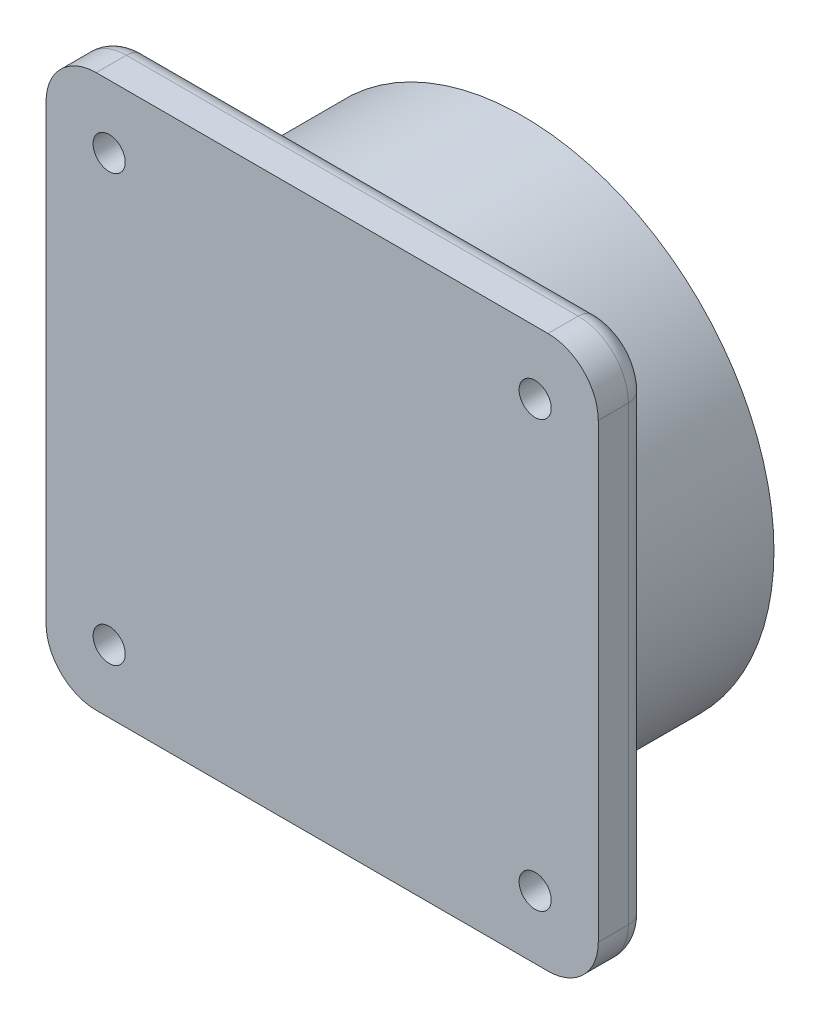
from build123d import *

# Parameters (mm, degrees)
SZKIC1_R                    = 25
SZKIC1_R_2                  = 22.6
DODANIE_WYCI_GNI_CIE1_DEPTH = 15
SZKIC2_R                    = 1.6
DODANIE_WYCI_GNI_CIE2_DEPTH = 5
ZAOKR_GLENIE3_R             = 2
ZAOKR_GLENIE4_R             = 1
SFAZOWANIE1_SIZE            = 2
SFAZOWANIE1_SIZE2           = 1.154700538


with BuildPart() as part:
    # Szkic1 → Dodanie-wyciągnięcie1 (new body)
    with BuildSketch(Plane.XY):
        Circle(SZKIC1_R)
        Circle(SZKIC1_R_2, mode=Mode.SUBTRACT)
    extrude(amount=DODANIE_WYCI_GNI_CIE1_DEPTH)

    # Szkic2 → Dodanie-wyciągnięcie2 (add)
    with BuildSketch(Plane.XY.offset(15)):
        with BuildLine():
            Line((-22.5, 27.5), (22.5, 27.5))
            ThreePointArc((22.5, 27.5), (26.035533906, 26.035533906), (27.5, 22.5))
            Line((27.5, 22.5), (27.5, -22.5))
            ThreePointArc((27.5, -22.5), (26.035533906, -26.035533906), (22.5, -27.5))
            Line((22.5, -27.5), (-22.5, -27.5))
            ThreePointArc((-22.5, -27.5), (-26.035533906, -26.035533906), (-27.5, -22.5))
            Line((-27.5, -22.5), (-27.5, 22.5))
            ThreePointArc((-27.5, 22.5), (-26.035533906, 26.035533906), (-22.5, 27.5))
        make_face()
        with Locations((-21.213203436, 21.213203436)):
            Circle(SZKIC2_R, mode=Mode.SUBTRACT)
        with Locations((21.213203436, 21.213203436)):
            Circle(SZKIC2_R, mode=Mode.SUBTRACT)
        with Locations((21.213203436, -21.213203436)):
            Circle(SZKIC2_R, mode=Mode.SUBTRACT)
        with Locations((-21.213203436, -21.213203436)):
            Circle(SZKIC2_R, mode=Mode.SUBTRACT)
    extrude(amount=DODANIE_WYCI_GNI_CIE2_DEPTH)

    # Zaokrąglenie3
    zaokr_glenie3_edges = [part.edges().sort_by_distance(p)[0] for p in [
        (-26.035533906, -26.035533906, 15),
        (0, -27.5, 15),
        (26.035533906, -26.035533906, 15),
        (27.5, 0, 15),
        (26.035533906, 26.035533906, 15),
        (0, 27.5, 15),
        (-26.035533906, 26.035533906, 15),
        (-27.5, 0, 15),
    ]]
    fillet(zaokr_glenie3_edges, radius=ZAOKR_GLENIE3_R)

    # Zaokrąglenie4
    zaokr_glenie4_edges = [part.edges().sort_by_distance(p)[0] for p in [
        (-25, 0, 15),
    ]]
    fillet(zaokr_glenie4_edges, radius=ZAOKR_GLENIE4_R)

    # Sfazowanie1
    sfazowanie1_edges = [part.edges().sort_by_distance(p)[0] for p in [
        (-22.6, 0, 0),
    ]]
    sfazowanie1_side = [part.faces().sort_by_distance(p)[0] for p in [
        (-22.6, 0, 7.5),
    ]]
    chamfer(sfazowanie1_edges, length=SFAZOWANIE1_SIZE, length2=SFAZOWANIE1_SIZE2, reference=sfazowanie1_side[0])


solid = part.part
